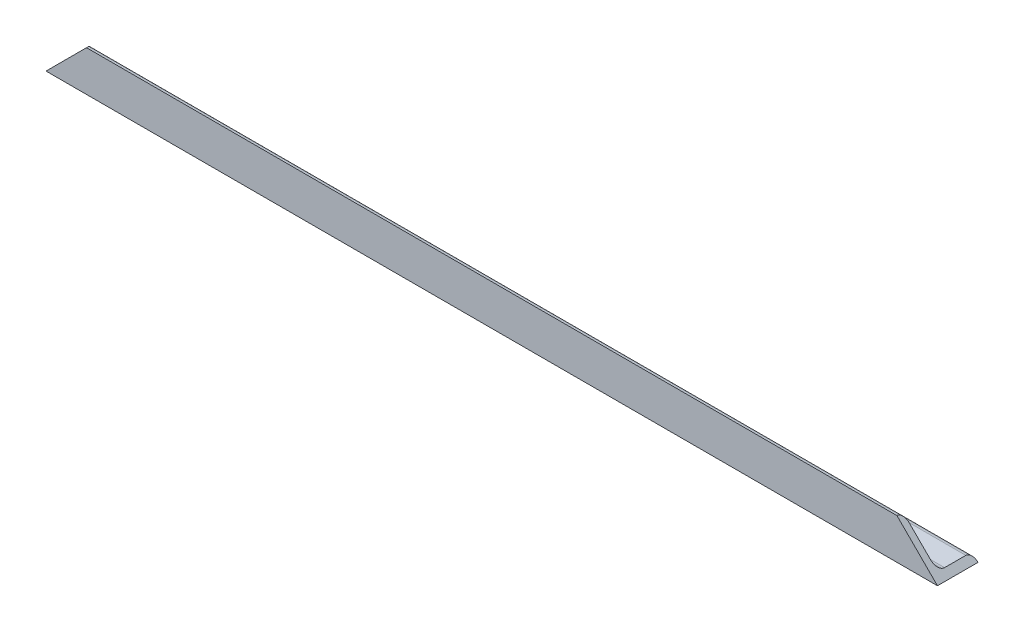
from build123d import *

# Parameters (mm, degrees)
L_ANGLE_EQUAL_20X20X3_2_DEPTH = 440
CUT_EXTRUDE1_DEPTH            = 441.908153701


with BuildPart() as part:
    # Sketch16 → L angle (equal) 20X20X3(2) (new body)
    with BuildSketch(Plane(origin=(0, 0, 0), x_dir=(0, 0, -1), z_dir=(1, 0, 0))):
        with BuildLine():
            Line((0, 20), (0, 0))
            Line((0, 0), (20, 0))
            ThreePointArc((20, 0), (19.121320344, 2.121320344), (17, 3))
            Line((17, 3), (6.5, 3))
            ThreePointArc((6.5, 3), (4.025126266, 4.025126266), (3, 6.5))
            Line((3, 6.5), (3, 17))
            ThreePointArc((3, 17), (2.121320344, 19.121320344), (0, 20))
        make_face()
    extrude(amount=L_ANGLE_EQUAL_20X20X3_2_DEPTH)

    # Sketch14 → Cut-Extrude1 (cut, through all)
    with BuildSketch(Plane.XY):
        Polygon((440, 0), (440, 20), (420, 20), align=None)
        Polygon((0, 20), (0, 0), (20, 20), align=None)
    extrude(amount=-CUT_EXTRUDE1_DEPTH, mode=Mode.SUBTRACT)


solid = part.part
